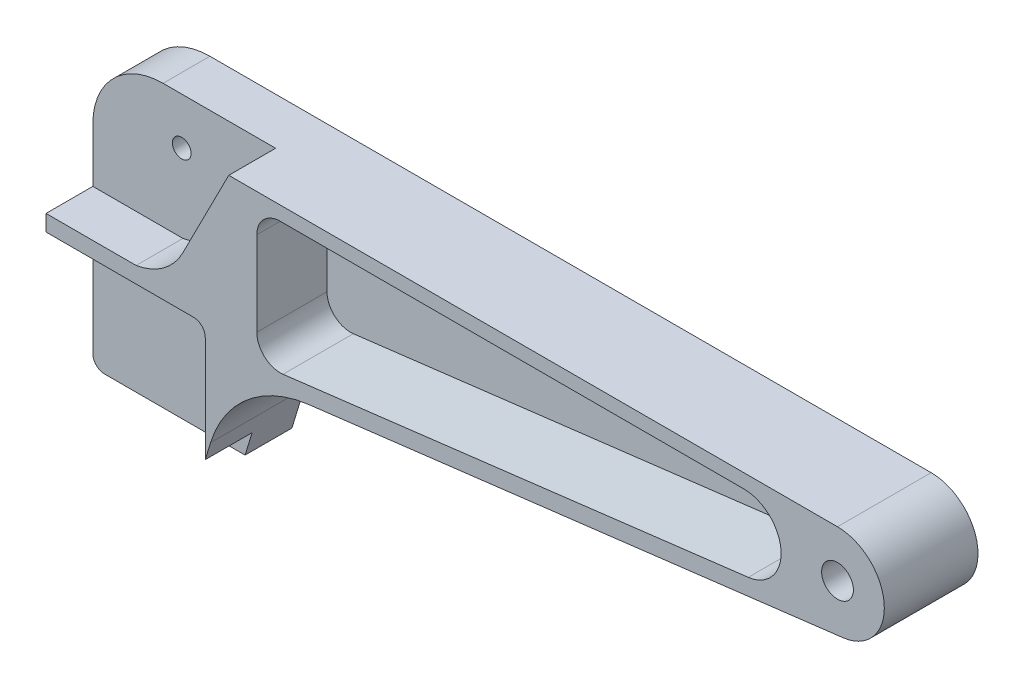
from build123d import *

# Parameters (mm, degrees)
SKETCH_1_R          = 6.791944052
SKETCH_1_R_2        = 3.995261207
EXTRUDE_1_DEPTH     = 40
CUT_EXTRUDE_1_DEPTH = 30
FILLET_1_R          = 50
SKETCH_3_W          = 68
SKETCH_3_H          = 60
CUT_EXTRUDE_2_DEPTH = 20
FILLET_2_R          = 30
FILLET_3_R          = 5
FILLET_4_R          = 5
CUT_EXTRUDE_3_DEPTH = 20


with BuildPart() as part:
    # ｽｹｯﾁ1 → ﾎﾞｽ - 押し出し1 (new body)
    with BuildSketch(Plane.XY):
        with BuildLine():
            Line((0, 0), (337.95498147, 0))
            ThreePointArc((337.95498147, 0), (357.931338385, -19.027804338), (339.897074223, -39.90548356))
            Line((339.897074223, -39.90548356), (79.782466467, -71.657339391))
            Line((79.782466467, -71.657339391), (65, -120))
            Line((65, -120), (0, -120))
            Line((0, -120), (0, 0))
        make_face()
        with Locations((337.95498147, -20)):
            Circle(SKETCH_1_R, mode=Mode.SUBTRACT)
        with Locations((37.95498147, -20)):
            Circle(SKETCH_1_R_2, mode=Mode.SUBTRACT)
    extrude(amount=EXTRUDE_1_DEPTH)

    # ｽｹｯﾁ2 → ｶｯﾄ - 押し出し1 (cut)
    with BuildSketch(Plane.XY.offset(40)):
        with BuildLine():
            Line((100, -6), (297.95498147, -6))
            ThreePointArc((297.95498147, -6), (313.853171972, -20.960808871), (299.884912284, -37.737756884))
            Line((299.884912284, -37.737756884), (101.211692948, -61.989541405))
            ThreePointArc((101.211692948, -61.989541405), (93.37115883, -59.550442937), (90, -52.063222842))
            Line((90, -52.063222842), (90, -16))
            ThreePointArc((90, -16), (92.928932188, -8.928932188), (100, -6))
        make_face()
    extrude(amount=-CUT_EXTRUDE_1_DEPTH, mode=Mode.SUBTRACT)

    # ﾌｨﾚｯﾄ1
    fillet_1_edges = [part.edges().sort_by_distance(p)[0] for p in [
        (79.782466467, -71.657339391, 20),
    ]]
    fillet(fillet_1_edges, radius=FILLET_1_R)

    # ｽｹｯﾁ3 → ｶｯﾄ - 押し出し2 (cut)
    with BuildSketch(Plane.XY.offset(40)):
        with Locations((34, -90)):
            Rectangle(SKETCH_3_W, SKETCH_3_H)
    extrude(amount=-CUT_EXTRUDE_2_DEPTH, mode=Mode.SUBTRACT)

    # ﾌｨﾚｯﾄ2
    fillet_2_edges = [part.edges().sort_by_distance(p)[0] for p in [
        (0, 0, 20),
    ]]
    fillet(fillet_2_edges, radius=FILLET_2_R)

    # ﾌｨﾚｯﾄ3
    fillet_3_edges = [part.edges().sort_by_distance(p)[0] for p in [
        (68, -60, 30),
    ]]
    fillet(fillet_3_edges, radius=FILLET_3_R)

    # ﾌｨﾚｯﾄ4
    fillet_4_edges = [part.edges().sort_by_distance(p)[0] for p in [
        (0, -120, 10),
    ]]
    fillet(fillet_4_edges, radius=FILLET_4_R)

    # ｽｹｯﾁ4 → ｶｯﾄ - 押し出し3 (cut)
    with BuildSketch(Plane.XY.offset(40)):
        with BuildLine():
            Line((78.036982516, 0), (58.355302576, -38.576774086))
            ThreePointArc((58.355302576, -38.576774086), (50.146919618, -48.212517196), (38.476348343, -53.113829488))
            Line((38.476348343, -53.113829488), (0, -53.113829488))
            Line((0, -53.113829488), (0, 0))
            Line((0, 0), (78.036982516, 0))
        make_face()
    extrude(amount=-CUT_EXTRUDE_3_DEPTH, mode=Mode.SUBTRACT)


solid = part.part
